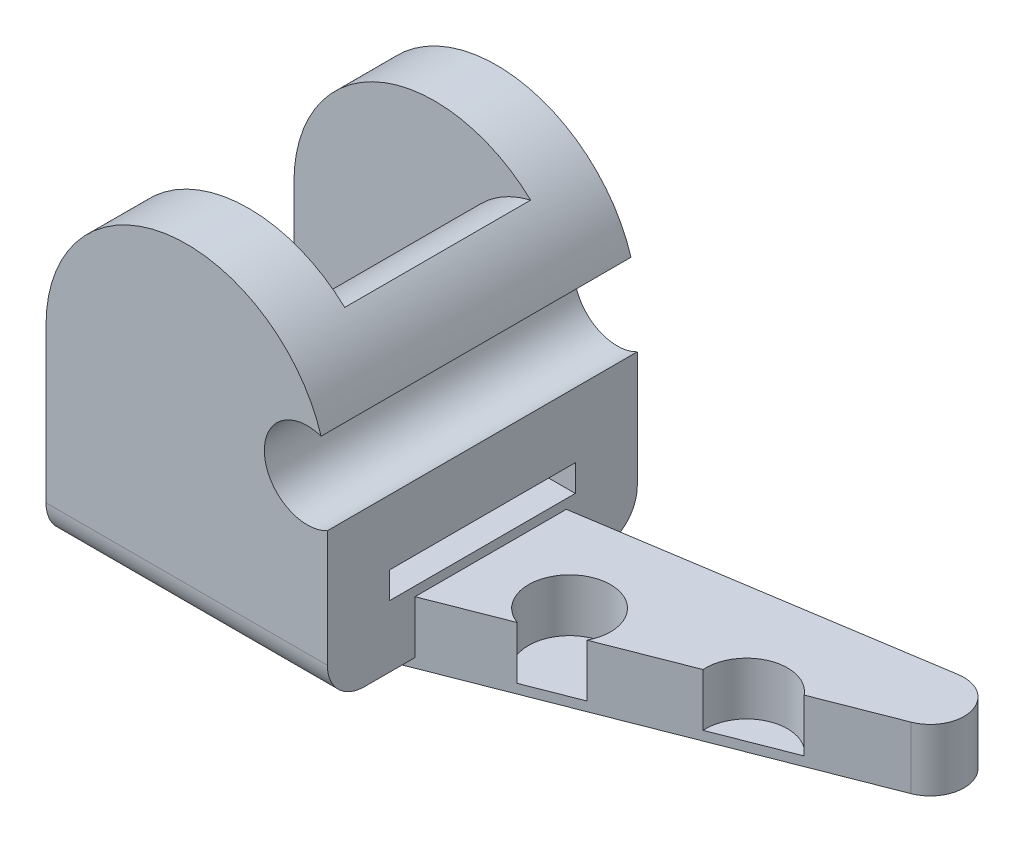
from build123d import *

# Parameters (mm, degrees)
U_SHAPE_DEPTH        = 100
SKETCH8_R            = 13.870670921
INNER_HOLE_DEPTH     = 126.918394305
THICKNESS_T          = -20
FILLET_2_R           = 12
TONGUE_DEPTH         = 20
SKETCH9_R            = 13.219756801
MOUNTING_HOLES_DEPTH = 223.42572915


with BuildPart() as part:
    # Sketch4 → "U" shape (new body)
    with BuildSketch(Plane.XY):
        with BuildLine():
            Line((-45.388843922, 0), (-45.388843922, -61.60596458))
            Line((-45.388843922, -61.60596458), (45.388843922, -61.60596458))
            Line((45.388843922, -61.60596458), (45.388843922, 0))
            ThreePointArc((45.388843922, 0), (0, 45.388843922), (-45.388843922, 0))
        make_face()
    extrude(amount=U_SHAPE_DEPTH)

    # Sketch8 → Inner Hole (cut, through all)
    with BuildSketch(Plane.XY.offset(100)):
        with Locations((38.923783738, 0.23491683)):
            Circle(SKETCH8_R)
    extrude(amount=-INNER_HOLE_DEPTH, mode=Mode.SUBTRACT)

    # Thickness
    thickness_openings = [part.faces().sort_by_distance(p)[0] for p in [
        (45.388843922, -36.821453076, 50),
        (-45.388843922, -30.80298229, 50),
        (-6.761547736, 44.882386576, 50),
    ]]
    offset(amount=THICKNESS_T, openings=thickness_openings, kind=Kind.INTERSECTION)

    # Fillet 2
    fillet_2_edges = [part.edges().sort_by_distance(p)[0] for p in [
        (0, -61.60596458, 100),
        (0, -61.60596458, 0),
    ]]
    fillet(fillet_2_edges, radius=FILLET_2_R)

    # Sketch7 → Tongue (add)
    with BuildSketch(Plane.XZ.offset(64.60596458)):
        with BuildLine():
            Line((24.518796564, 26.143873614), (154.843931452, 5.821988173))
            ThreePointArc((154.843931452, 5.821988173), (167.031484247, 13.741465613), (160.484216098, 26.717899862))
            Line((160.484216098, 26.717899862), (37.634315602, 74.733748908))
            Line((37.634315602, 74.733748908), (24.518796564, 26.143873614))
        make_face()
    extrude(amount=-TONGUE_DEPTH)

    # Sketch9 → Mounting Holes (cut, through all)
    with BuildSketch(Plane.XZ.offset(61.60596458)):
        with Locations((73.545474364, 50)):
            Circle(SKETCH9_R)
        with Locations((125.389042853, 44.726843721)):
            Circle(SKETCH9_R)
    extrude(amount=-MOUNTING_HOLES_DEPTH, mode=Mode.SUBTRACT)


solid = part.part
